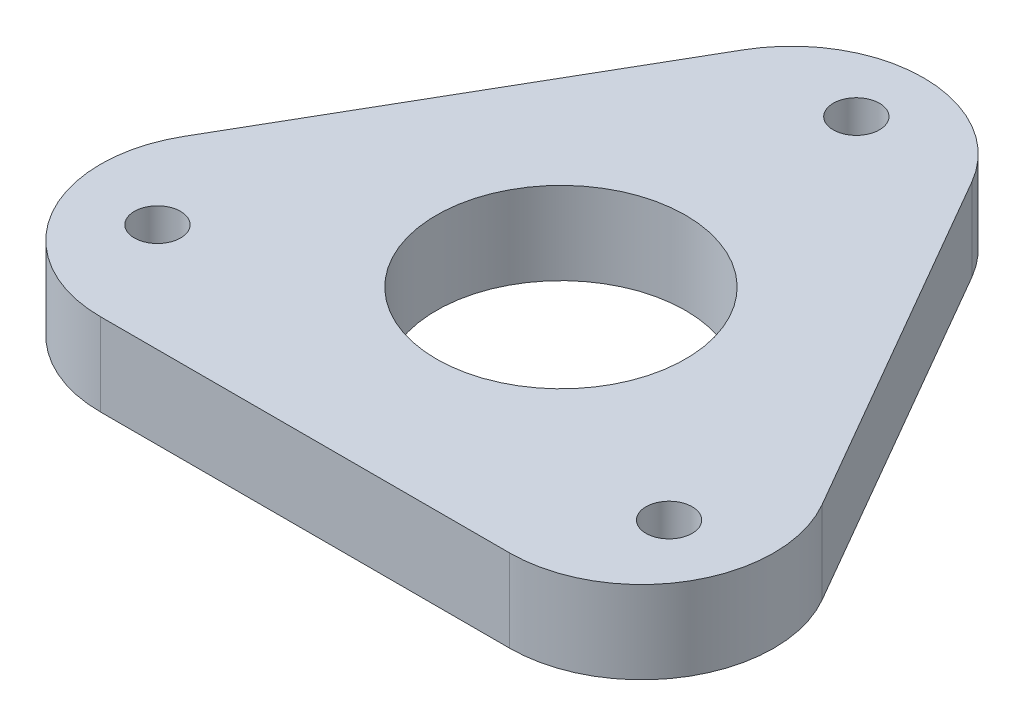
from build123d import *

# Parameters (mm, degrees)
BOSS_EXTRUDE1_DEPTH = 25
SKETCH2_R           = 37.75
CUT_EXTRUDE1_DEPTH  = 28
SKETCH3_R           = 7
CUT_EXTRUDE2_DEPTH  = 173.13028653


with BuildPart() as part:
    # Sketch1 → Boss-Extrude1 (new body)
    with BuildSketch(Plane(origin=(0, 0, 0), x_dir=(1, 0, 0), z_dir=(0, 1, 0))):
        with BuildLine():
            Line((66.645984298, 85.104941493), (128.643951995, -22.278688525))
            ThreePointArc((128.643951995, -22.278688525), (128.643951995, -62.278688525), (94.002935844, -82.278688525))
            Line((94.002935844, -82.278688525), (-29.992999551, -82.278688525))
            ThreePointArc((-29.992999551, -82.278688525), (-64.634015702, -62.278688525), (-64.634015702, -22.278688525))
            Line((-64.634015702, -22.278688525), (-2.636048005, 85.104941493))
            ThreePointArc((-2.636048005, 85.104941493), (32.004968146, 105.104941493), (66.645984298, 85.104941493))
        make_face()
    extrude(amount=BOSS_EXTRUDE1_DEPTH)

    # Sketch2 → Cut-Extrude1 (cut)
    with BuildSketch(Plane(origin=(0, 25, 0), x_dir=(1, 0, 0), z_dir=(0, 1, 0))):
        with Locations(Location((32.004968146, -4.752094378, 0), (0, 0, 270))):
            Circle(SKETCH2_R)
    extrude(amount=-CUT_EXTRUDE1_DEPTH, mode=Mode.SUBTRACT)

    # Sketch3 → Cut-Extrude2 (cut, through all)
    with BuildSketch(Plane(origin=(0, 25, 0), x_dir=(1, 0, 0), z_dir=(0, 1, 0))):
        with Locations(Location((32.004968146, 84.737197347, 0), (0, 0, 270))):
            Circle(SKETCH3_R)
        with Locations(Location((109.504968146, -49.49674024, 0), (0, 0, 270))):
            Circle(SKETCH3_R)
        with Locations(Location((-45.495031854, -49.49674024, 0), (0, 0, 270))):
            Circle(SKETCH3_R)
    extrude(amount=-CUT_EXTRUDE2_DEPTH, mode=Mode.SUBTRACT)


solid = part.part
